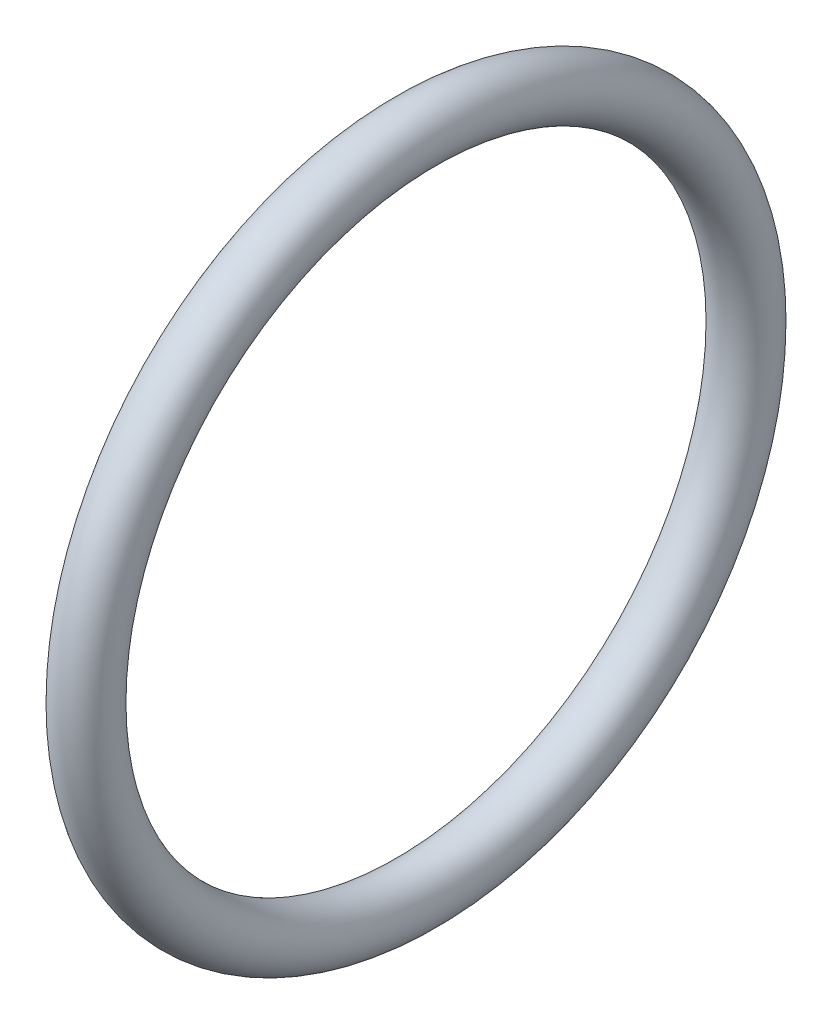
from build123d import *

# Parameters (mm, degrees)
SKETCH1_R = 1.125


with BuildPart() as part:
    # Sketch1 → Base-Revolve (revolve)
    with BuildSketch(Plane.XY, mode=Mode.PRIVATE) as base_revolve_sk:
        with Locations((1.125, 13.125)):
            Circle(SKETCH1_R)
    revolve(base_revolve_sk.sketch.rotate(Axis((0, 0, 0), (1, 0, 0)), 90), axis=Axis((0, 0, 0), (1, 0, 0)))


solid = part.part
